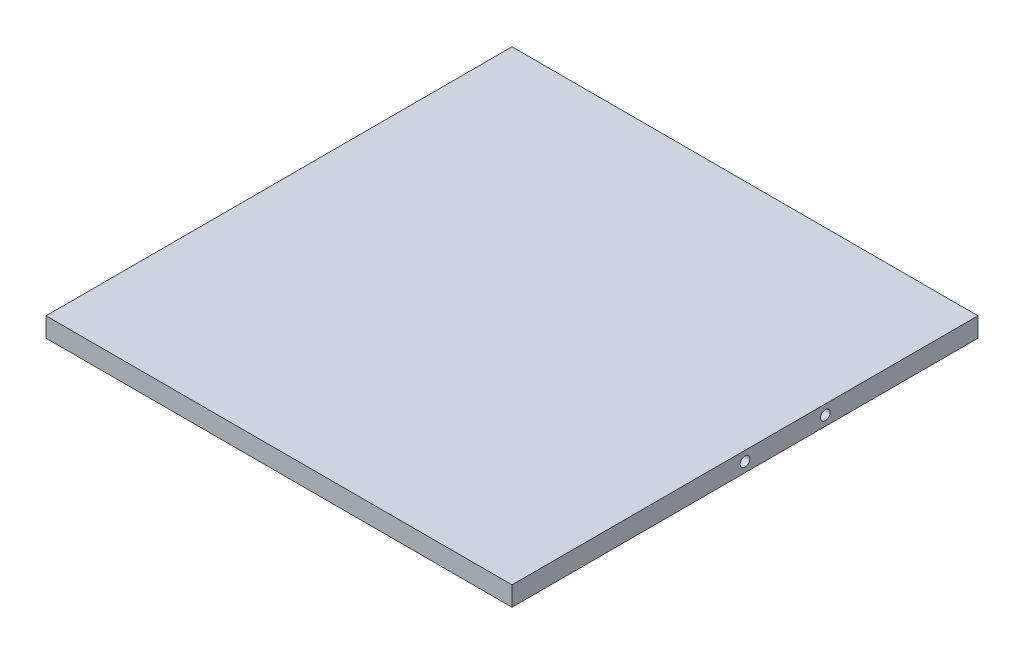
from build123d import *

# Parameters (mm, degrees)
SKETCH2_W           = 304.8
SKETCH2_H           = 304.8
BOSS_EXTRUDE1_DEPTH = 12.7
SKETCH3_R           = 3.175
CUT_EXTRUDE1_DEPTH  = 343.16151121
SKETCH4_R           = 3.175
CUT_EXTRUDE2_DEPTH  = 343.16151121


with BuildPart() as part:
    # Sketch2 → Boss-Extrude1 (new body)
    with BuildSketch(Plane(origin=(0, 0, 0), x_dir=(1, 0, 0), z_dir=(0, 1, 0))):
        with Locations((-98.440191388, 2.55215311)):
            Rectangle(SKETCH2_W, SKETCH2_H)
    extrude(amount=BOSS_EXTRUDE1_DEPTH)

    # Sketch3 → Cut-Extrude1 (cut, through all)
    with BuildSketch(Plane(origin=(53.959808612, 0, 0), x_dir=(0, 0, -1), z_dir=(1, 0, 0))):
        with Locations((2.55215311, 6.35)):
            Circle(SKETCH3_R)
    extrude(amount=-CUT_EXTRUDE1_DEPTH, mode=Mode.SUBTRACT)

    # Sketch4 → Cut-Extrude2 (cut, through all)
    with BuildSketch(Plane.ZY.offset(250.840191388)):
        with Locations((-55.108982592, 6.35)):
            Circle(SKETCH4_R)
    extrude(amount=-CUT_EXTRUDE2_DEPTH, mode=Mode.SUBTRACT)


solid = part.part
